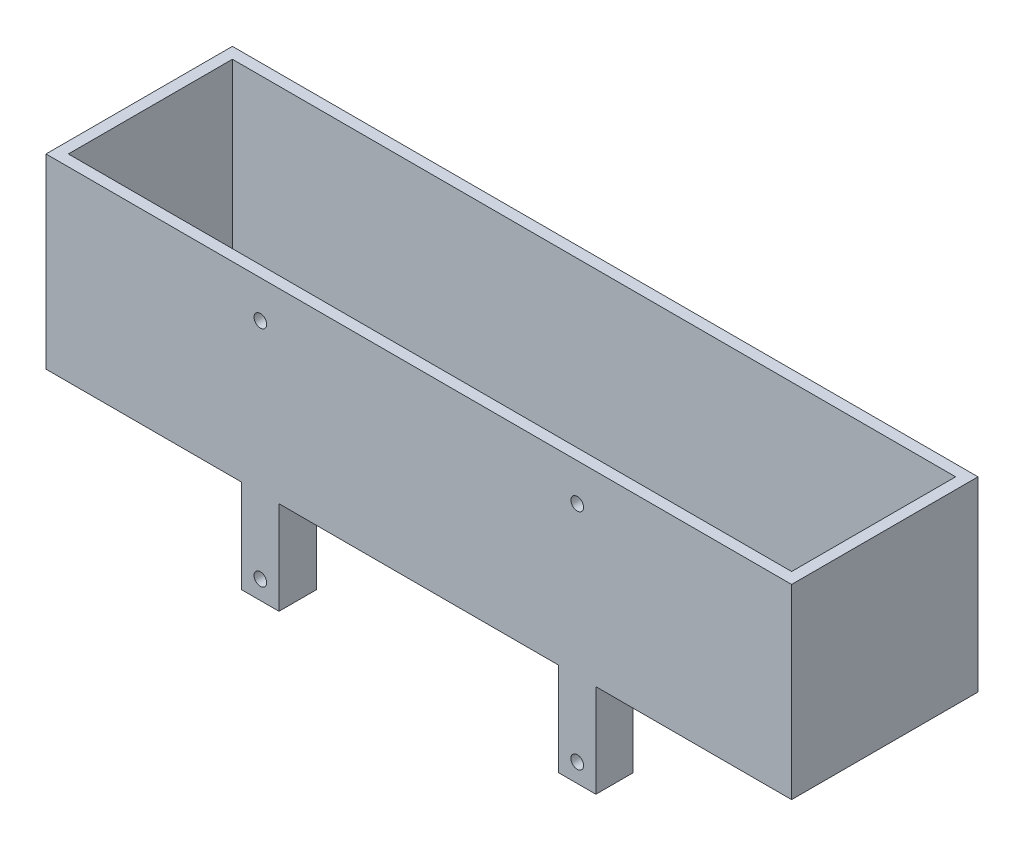
from build123d import *

# Parameters (mm, degrees)
BOX_FOOTPRINT_200_X_50_MM_W                     = 200
BOX_FOOTPRINT_200_X_50_MM_H                     = 50
BOX_HEIGHT_50_MM_DEPTH                          = 50
REAR_OPENING_194_X_44_MM_W                      = 194
REAR_OPENING_194_X_44_MM_H                      = 44
REAR_CAVITY_WALL_3_MM_DEPTH                     = 47
TWO_SQUARE_ARMS_10_X_10_PITCH_85_MM_W           = 10
TWO_SQUARE_ARMS_10_X_10_PITCH_85_MM_H           = 10
FORWARD_SQUARE_ARMS_25_MM_DEPTH                 = 25
TEMPORARY_CHASSIS_HOLES_140_X_20_MM_R           = 1.7
F_4X_M3_CLEARANCE_DIAMETER_3_4_MM_DEPTH         = 3
PCB_REAR_PAIR_PITCH_85_MM_R                     = 1.7
F_2X_ROOF_HOLES_DIAMETER_3_4_MM_DEPTH           = 3
PCB_FRONT_PAIR_ROW_SPACING_60_MM_R              = 1.7
F_2X_ARM_HOLES_THROUGH_TOP_AND_BOTTOM_3_4_DEPTH = 10


with BuildPart() as part:
    # Box footprint 200 x 50 mm → Box height 50 mm (new body)
    with BuildSketch(Plane.XY):
        with Locations((0, 25)):
            Rectangle(BOX_FOOTPRINT_200_X_50_MM_W, BOX_FOOTPRINT_200_X_50_MM_H)
    extrude(amount=BOX_HEIGHT_50_MM_DEPTH)

    # Rear opening 194 x 44 mm → Rear cavity - wall 3 mm (cut)
    with BuildSketch(Plane(origin=(0, 50, 0), x_dir=(1, 0, 0), z_dir=(0, 1, 0))):
        with Locations((0, -25)):
            Rectangle(REAR_OPENING_194_X_44_MM_W, REAR_OPENING_194_X_44_MM_H)
    extrude(amount=-REAR_CAVITY_WALL_3_MM_DEPTH, mode=Mode.SUBTRACT)

    # Two square arms 10 x 10 - pitch 85 mm → Forward square arms 25 mm (add)
    with BuildSketch(Plane.XZ):
        with Locations((-42.5, 45)):
            Rectangle(TWO_SQUARE_ARMS_10_X_10_PITCH_85_MM_W, TWO_SQUARE_ARMS_10_X_10_PITCH_85_MM_H)
        with Locations((42.5, 45)):
            Rectangle(TWO_SQUARE_ARMS_10_X_10_PITCH_85_MM_W, TWO_SQUARE_ARMS_10_X_10_PITCH_85_MM_H)
    extrude(amount=FORWARD_SQUARE_ARMS_25_MM_DEPTH)

    # Temporary chassis holes - 140 x 20 mm → 4x M3 clearance diameter 3.4 mm (cut)
    with BuildSketch(Plane.XZ):
        with Locations(Location((-70, 15, 0), (0, 0, 270))):
            Circle(TEMPORARY_CHASSIS_HOLES_140_X_20_MM_R)
        with Locations(Location((-70, 35, 0), (0, 0, 270))):
            Circle(TEMPORARY_CHASSIS_HOLES_140_X_20_MM_R)
        with Locations(Location((70, 15, 0), (0, 0, 270))):
            Circle(TEMPORARY_CHASSIS_HOLES_140_X_20_MM_R)
        with Locations(Location((70, 35, 0), (0, 0, 270))):
            Circle(TEMPORARY_CHASSIS_HOLES_140_X_20_MM_R)
    extrude(amount=-F_4X_M3_CLEARANCE_DIAMETER_3_4_MM_DEPTH, mode=Mode.SUBTRACT)

    # PCB rear pair - pitch 85 mm → 2x roof holes diameter 3.4 mm (cut)
    with BuildSketch(Plane.XY.offset(50)):
        with Locations((-42.5, 40)):
            Circle(PCB_REAR_PAIR_PITCH_85_MM_R)
        with Locations((42.5, 40)):
            Circle(PCB_REAR_PAIR_PITCH_85_MM_R)
    extrude(amount=-F_2X_ROOF_HOLES_DIAMETER_3_4_MM_DEPTH, mode=Mode.SUBTRACT)

    # PCB front pair - row spacing 60 mm → 2x arm holes through top and bottom 3.4 mm (cut)
    with BuildSketch(Plane.XY.offset(50)):
        with Locations((-42.5, -20)):
            Circle(PCB_FRONT_PAIR_ROW_SPACING_60_MM_R)
        with Locations((42.5, -20)):
            Circle(PCB_FRONT_PAIR_ROW_SPACING_60_MM_R)
    extrude(amount=-F_2X_ARM_HOLES_THROUGH_TOP_AND_BOTTOM_3_4_DEPTH, mode=Mode.SUBTRACT)


solid = part.part
